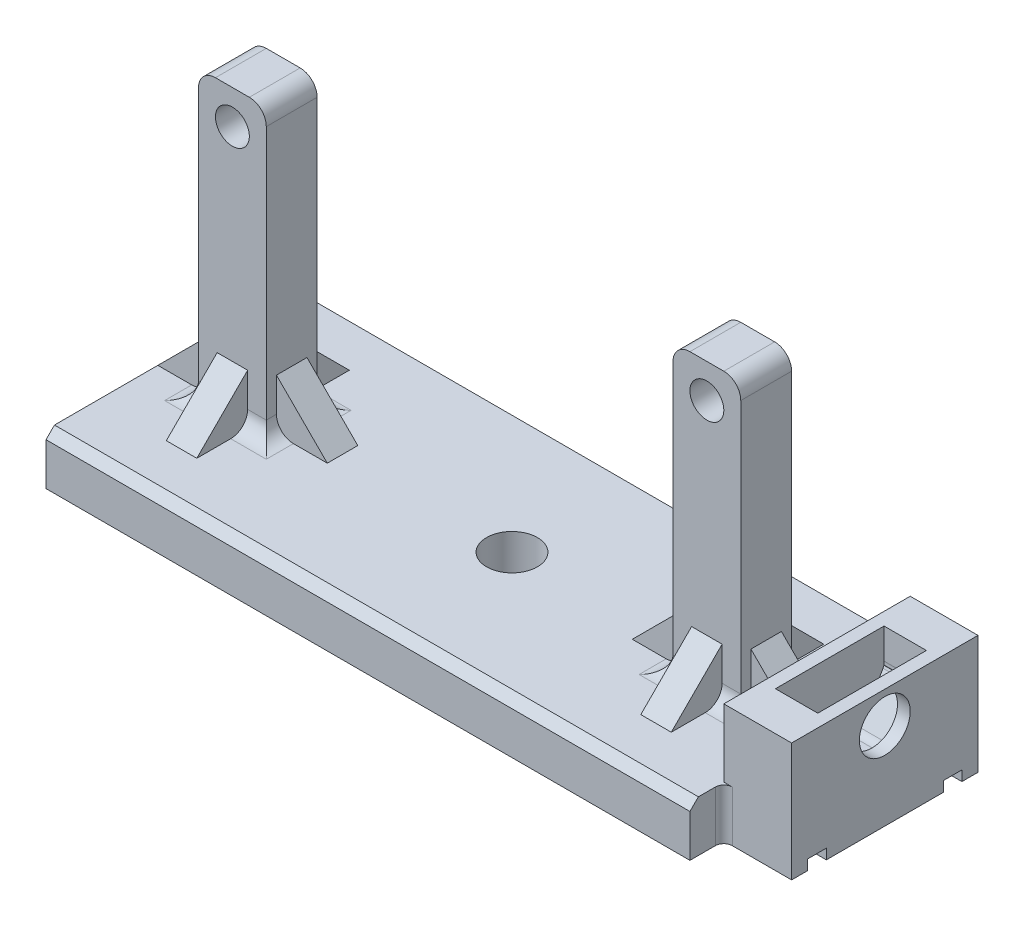
from build123d import *

# Parameters (mm, degrees)
CROQUIS1_R                   = 1
SALIENTE_EXTRUIR1_DEPTH      = 1.5
CROQUIS2_W                   = 38
CROQUIS2_H                   = 3
SALIENTE_EXTRUIR2_DEPTH      = 6
CROQUIS3_W                   = 38
CROQUIS3_H                   = 3
SALIENTE_EXTRUIR3_DEPTH      = 6
REDONDEO1_R                  = 1
NERVIO1_REACH                = 45.592
CROQUIS4_WALL_W              = 93.426354762
CROQUIS4_WALL_H              = 1.8
NERVIO5_REACH                = 45.592
CROQUIS5_WALL_W              = 93.426354762
CROQUIS5_WALL_H              = 1.8
NERVIO6_REACH                = 41.31
CROQUIS6_WALL_W              = 84.861976732
CROQUIS6_WALL_H              = 1.8
NERVIO7_REACH                = 41.31
CROQUIS7_WALL_W              = 84.861976732
CROQUIS7_WALL_H              = 1.8
REDONDEO2_R                  = 1
CROQUIS8_W                   = 38
CROQUIS8_H                   = 1.1
CROQUIS8_W_2                 = 38.249115133
CORTAR_EXTRUIR1_DEPTH        = 0.6
SALIENTE_EXTRUIR5_DEPTH      = 4
SALIENTE_EXTRUIR5_DEPTH_BACK = 3
CROQUIS10_W                  = 4
CROQUIS10_H                  = 11
CORTAR_EXTRUIR2_START        = -2
CORTAR_EXTRUIR2_DEPTH        = 1.25
REDONDEO5_R                  = 0.5
CROQUIS13_W                  = 4
CROQUIS13_H                  = 1.1
CORTAR_EXTRUIR4_DEPTH        = 0.6
CROQUIS14_W                  = 2.5
CROQUIS14_H                  = 6.410956056
CORTAR_EXTRUIR5_DEPTH        = 2
CORTAR_EXTRUIR6_START        = -3.25
CROQUIS11_3_R                = 1.5
CORTAR_EXTRUIR6_DEPTH        = 4
CORTAR_EXTRUIR7_REACH        = 47.927
CROQUIS16_R                  = 1.5
REDONDEO6_R                  = 0.5
CHAFL_N1_SIZE                = 0.5


with BuildPart() as part:
    # Croquis1 → Saliente-Extruir1 (new, symmetric)
    with BuildSketch(Plane.XY):
        Polygon((0, 0), (38, 0), (38, 3), (35, 3), (35, 20), (31, 20), (31, 3), (7, 3), (7, 20), (3, 20), (3, 3), (0, 3), align=None)
        with Locations((5, 18)):
            Circle(CROQUIS1_R, mode=Mode.SUBTRACT)
        with Locations((33, 18)):
            Circle(CROQUIS1_R, mode=Mode.SUBTRACT)
    extrude(amount=SALIENTE_EXTRUIR1_DEPTH, both=True)

    # Croquis2 → Saliente-Extruir2 (add)
    with BuildSketch(Plane.XY.offset(1.5)):
        with Locations((19, 1.5)):
            Rectangle(CROQUIS2_W, CROQUIS2_H)
    extrude(amount=SALIENTE_EXTRUIR2_DEPTH)

    # Croquis3 → Saliente-Extruir3 (add)
    with BuildSketch(Plane(origin=(0, 0, -1.5), x_dir=(-1, 0, 0), z_dir=(0, 0, -1))):
        with Locations((-19, 1.5)):
            Rectangle(CROQUIS3_W, CROQUIS3_H)
    extrude(amount=SALIENTE_EXTRUIR3_DEPTH)

    # Redondeo1
    redondeo1_edges = [part.edges().sort_by_distance(p)[0] for p in [
        (3, 20, 0),
        (7, 20, 0),
        (31, 20, 0),
        (35, 20, 0),
    ]]
    fillet(redondeo1_edges, radius=REDONDEO1_R)

    # Croquis4 wall → Nervio1 (add, up to next)
    with BuildSketch(Plane(origin=(36.5, 4.5, 0), x_dir=(0.707106781187, -0.707106781187, 0), z_dir=(0.707106781187, 0.707106781187, 0)), mode=Mode.PRIVATE) as nervio1_sk1:
        Rectangle(CROQUIS4_WALL_W, CROQUIS4_WALL_H)
    nervio1_tool1 = extrude(nervio1_sk1.sketch, amount=-NERVIO1_REACH, mode=Mode.PRIVATE) - part.part
    nervio1 = nervio1_tool1.solids().sort_by_distance((36.5, 4.5, 0))[0]
    add(nervio1)

    # Croquis5 wall → Nervio5 (add, up to next)
    with BuildSketch(Plane(origin=(29.5, 4.5, 0), x_dir=(-0.707106781187, -0.707106781187, 0), z_dir=(0.707106781187, -0.707106781187, 0)), mode=Mode.PRIVATE) as nervio5_sk1:
        Rectangle(CROQUIS5_WALL_W, CROQUIS5_WALL_H)
    nervio5_tool1 = extrude(nervio5_sk1.sketch, amount=NERVIO5_REACH, mode=Mode.PRIVATE) - part.part
    nervio5 = nervio5_tool1.solids().sort_by_distance((29.5, 4.5, 0))[0]
    add(nervio5)

    # Croquis6 wall → Nervio6 (add, up to next)
    with BuildSketch(Plane(origin=(33, 4.5, -3), x_dir=(0, -0.707106781187, -0.707106781187), z_dir=(0, 0.707106781187, -0.707106781187)), mode=Mode.PRIVATE) as nervio6_sk1:
        Rectangle(CROQUIS6_WALL_W, CROQUIS6_WALL_H)
    nervio6_tool1 = extrude(nervio6_sk1.sketch, amount=-NERVIO6_REACH, mode=Mode.PRIVATE) - part.part
    nervio6 = nervio6_tool1.solids().sort_by_distance((33, 4.5, -3))[0]
    add(nervio6)

    # Croquis7 wall → Nervio7 (add, up to next)
    with BuildSketch(Plane(origin=(33, 4.5, 3), x_dir=(0, -0.707106781187, 0.707106781187), z_dir=(0, -0.707106781187, -0.707106781187)), mode=Mode.PRIVATE) as nervio7_sk1:
        Rectangle(CROQUIS7_WALL_W, CROQUIS7_WALL_H)
    nervio7_tool1 = extrude(nervio7_sk1.sketch, amount=NERVIO7_REACH, mode=Mode.PRIVATE) - part.part
    nervio7 = nervio7_tool1.solids().sort_by_distance((33, 4.5, 3))[0]
    add(nervio7)

    # Simetría3: Nervio1, Nervio5, Nervio6, Nervio7 across plane
    add(nervio1.mirror(Plane.ZY.offset(-19)))
    add(nervio5.mirror(Plane.ZY.offset(-19)))
    add(nervio6.mirror(Plane.ZY.offset(-19)))
    add(nervio7.mirror(Plane.ZY.offset(-19)))

    # Redondeo2
    redondeo2_edges = [part.edges().sort_by_distance(p)[0] for p in [
        (35, 3, -1.2),
        (31, 3, -1.2),
        (34.45, 3, -1.5),
        (3, 3, 1.2),
        (7, 3, 1.2),
        (31.55, 3, 1.5),
        (31, 3, 1.2),
        (35, 3, 1.2),
        (3, 3, -1.2),
        (7, 3, -1.2),
        (6.45, 3, -1.5),
        (3.55, 3, 1.5),
        (6.45, 3, 1.5),
        (34.45, 3, 1.5),
        (31.55, 3, -1.5),
        (3.55, 3, -1.5),
    ]]
    fillet(redondeo2_edges, radius=REDONDEO2_R)

    # Croquis8 → Cortar-Extruir1 (cut)
    with BuildSketch(Plane.XZ):
        with Locations((19, 4)):
            Rectangle(CROQUIS8_W, CROQUIS8_H)
        with Locations((19.124557567, -4)):
            Rectangle(CROQUIS8_W_2, CROQUIS8_H)
    extrude(amount=-CORTAR_EXTRUIR1_DEPTH, mode=Mode.SUBTRACT)

    # Croquis10 → Saliente-Extruir5 (add, two sides: drawn at the far end of the back side and taken through both)
    with BuildSketch(Plane(origin=(0, 3, 0), x_dir=(1, 0, 0), z_dir=(0, 1, 0)).offset(-SALIENTE_EXTRUIR5_DEPTH_BACK)):
        with Locations((40, 0)):
            Rectangle(CROQUIS10_W, CROQUIS10_H)
    extrude(amount=SALIENTE_EXTRUIR5_DEPTH + SALIENTE_EXTRUIR5_DEPTH_BACK)

    # Croquis11 → Cortar-Extruir2 (cut, symmetric)
    with BuildSketch(Plane.ZY.offset(-38).offset(CORTAR_EXTRUIR2_START)):
        Polygon((1.645448267, 2.27), (3.290896534, 5.12), (1.645448267, 7.97), (-1.645448267, 7.97), (-3.290896534, 5.12), (-1.645448267, 2.27), align=None)
    extrude(amount=CORTAR_EXTRUIR2_DEPTH, both=True, mode=Mode.SUBTRACT)

    # Redondeo5
    redondeo5_edges = [part.edges().sort_by_distance(p)[0] for p in [
        (40, 5.12, -3.290896534),
        (40, 2.27, -1.645448267),
        (40, 2.27, 1.645448267),
        (40, 5.12, 3.290896534),
    ]]
    fillet(redondeo5_edges, radius=REDONDEO5_R)

    # Croquis13 → Cortar-Extruir4 (cut)
    with BuildSketch(Plane.XZ):
        with Locations((40, 4)):
            Rectangle(CROQUIS13_W, CROQUIS13_H)
        with Locations((40, -4)):
            Rectangle(CROQUIS13_W, CROQUIS13_H)
    extrude(amount=-CORTAR_EXTRUIR4_DEPTH, mode=Mode.SUBTRACT)

    # Croquis14 → Cortar-Extruir5 (cut)
    with BuildSketch(Plane(origin=(0, 7, 0), x_dir=(1, 0, 0), z_dir=(0, 1, 0))):
        with Locations((40, 0)):
            Rectangle(CROQUIS14_W, CROQUIS14_H)
    extrude(amount=-CORTAR_EXTRUIR5_DEPTH, mode=Mode.SUBTRACT)

    # Croquis11<3> → Cortar-Extruir6 (cut)
    with BuildSketch(Plane.ZY.offset(-38).offset(CORTAR_EXTRUIR6_START)):
        with Locations((0, 5.12)):
            Circle(CROQUIS11_3_R)
    extrude(amount=-CORTAR_EXTRUIR6_DEPTH, mode=Mode.SUBTRACT)

    # Croquis16 → Cortar-Extruir7 (cut, up to next)
    with BuildSketch(Plane(origin=(0, 3, 0), x_dir=(1, 0, 0), z_dir=(0, 1, 0)), mode=Mode.PRIVATE) as cortar_extruir7_sk1:
        with Locations(Location((20, 0, 0), (0, 0, 270))):
            Circle(CROQUIS16_R)
    cortar_extruir7_tool1 = extrude(cortar_extruir7_sk1.sketch, amount=-CORTAR_EXTRUIR7_REACH, mode=Mode.PRIVATE) & part.part
    add(cortar_extruir7_tool1.solids().sort_by_distance((20, 3, 0))[0], mode=Mode.SUBTRACT)

    # Redondeo6
    redondeo6_edges = [part.edges().sort_by_distance(p)[0] for p in [
        (38, 1.5, 5.5),
        (38, 1.5, -5.5),
    ]]
    fillet(redondeo6_edges, radius=REDONDEO6_R)

    # Chaflán1
    chafl_n1_edges = [part.edges().sort_by_distance(p)[0] for p in [
        (19, 3, 7.5),
        (19, 3, -7.5),
    ]]
    chamfer(chafl_n1_edges, length=CHAFL_N1_SIZE)


solid = part.part
